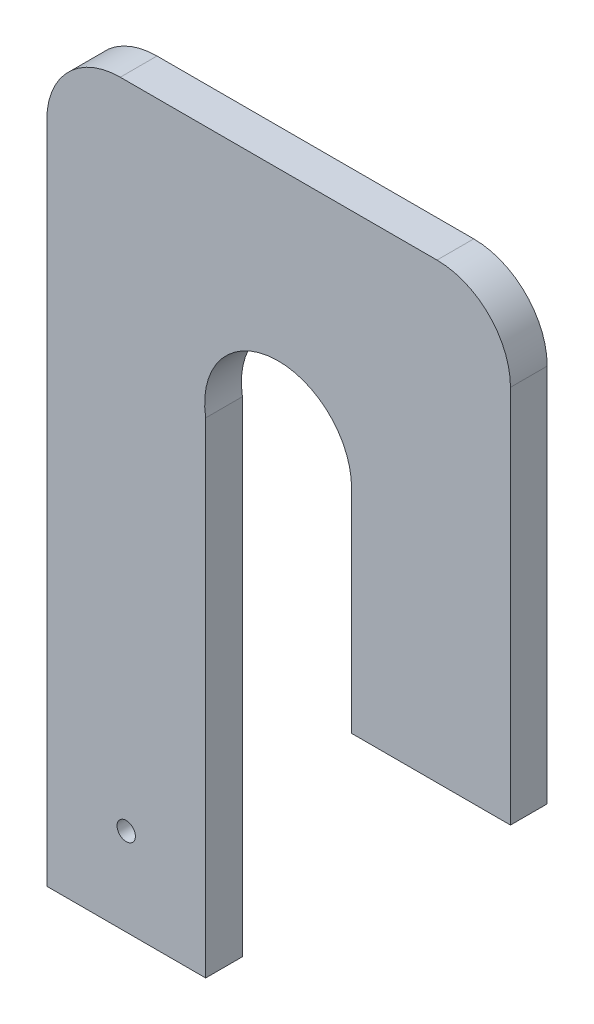
from build123d import *

# Parameters (mm, degrees)
BOSS_EXTRUDE2_DEPTH = 12.7
FILLET1_R           = 25.4
FILLET2_R           = 25.4
SKETCH3_R           = 3.175
CUT_EXTRUDE3_DEPTH  = 12.7


with BuildPart() as part:
    # Sketch1 → Boss-Extrude2 (new body)
    with BuildSketch(Plane.XY):
        with BuildLine():
            Line((0, 167.705976621), (0, 0))
            Line((0, 0), (-54.924735551, 0))
            Line((-54.924735551, 0), (-54.924735551, 254.93724428))
            Line((-54.924735551, 254.93724428), (105.37332707, 254.93724428))
            Line((105.37332707, 254.93724428), (105.37332707, 173.075661403))
            Line((105.37332707, 173.075661403), (105.37332707, 98.46451231))
            Line((105.37332707, 98.46451231), (50.448591519, 98.46451231))
            Line((50.448591519, 98.46451231), (50.448591519, 171.91644725))
            ThreePointArc((50.448591519, 171.91644725), (22.936036736, 197.228442673), (0, 167.705976621))
        make_face()
    extrude(amount=BOSS_EXTRUDE2_DEPTH)

    # Fillet1
    fillet1_edges = [part.edges().sort_by_distance(p)[0] for p in [
        (-54.924735551, 254.93724428, 6.35),
    ]]
    fillet(fillet1_edges, radius=FILLET1_R)

    # Fillet2
    fillet2_edges = [part.edges().sort_by_distance(p)[0] for p in [
        (105.37332707, 254.93724428, 6.35),
    ]]
    fillet(fillet2_edges, radius=FILLET2_R)

    # Sketch3 → Cut-Extrude3 (cut)
    with BuildSketch(Plane.XY.offset(12.7)):
        with Locations((-27.462367775, 30.26240116)):
            Circle(SKETCH3_R)
    extrude(amount=-CUT_EXTRUDE3_DEPTH, mode=Mode.SUBTRACT)


solid = part.part
